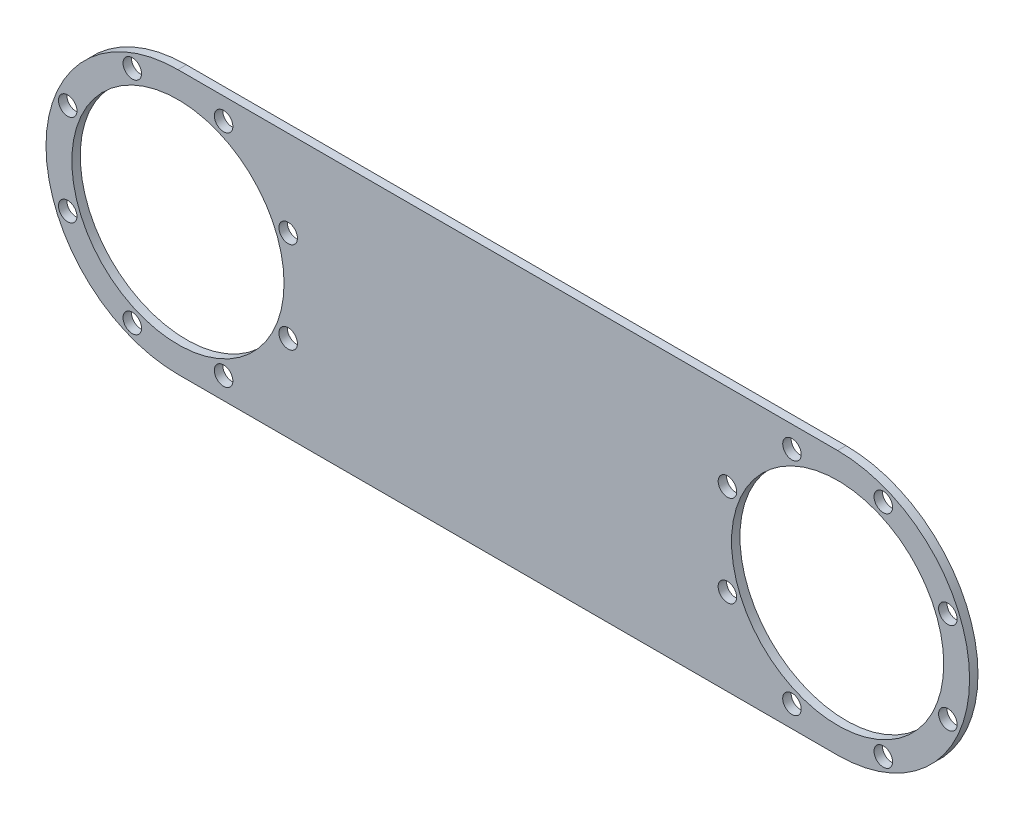
from build123d import *

# Parameters (mm, degrees)
SKETCH_1_R      = 3.3
SKETCH_1_R_2    = 37.8
EXTRUDE_1_DEPTH = 3


with BuildPart() as part:
    # 草图1 → 凸台-拉伸1 (new body)
    with BuildSketch(Plane.XY):
        with BuildLine():
            Line((0, -47), (235, -47))
            ThreePointArc((235, -47), (282, 0), (235, 47))
            Line((235, 47), (0, 47))
            ThreePointArc((0, 47), (-47, 0), (0, -47))
        make_face()
        with Locations((16.264045876, -39.264880132)):
            Circle(SKETCH_1_R, mode=Mode.SUBTRACT)
        with Locations((39.264880132, -16.264045876)):
            Circle(SKETCH_1_R, mode=Mode.SUBTRACT)
        with Locations((39.264880132, 16.264045876)):
            Circle(SKETCH_1_R, mode=Mode.SUBTRACT)
        with Locations((16.264045876, 39.264880132)):
            Circle(SKETCH_1_R, mode=Mode.SUBTRACT)
        with Locations((-16.264045876, 39.264880132)):
            Circle(SKETCH_1_R, mode=Mode.SUBTRACT)
        with Locations((-39.264880132, 16.264045876)):
            Circle(SKETCH_1_R, mode=Mode.SUBTRACT)
        with Locations((-39.264880132, -16.264045876)):
            Circle(SKETCH_1_R, mode=Mode.SUBTRACT)
        with Locations((-16.264045876, -39.264880132)):
            Circle(SKETCH_1_R, mode=Mode.SUBTRACT)
        with Locations((251.264045876, -39.264880132)):
            Circle(SKETCH_1_R, mode=Mode.SUBTRACT)
        with Locations((274.264880132, -16.264045876)):
            Circle(SKETCH_1_R, mode=Mode.SUBTRACT)
        with Locations((274.264880132, 16.264045876)):
            Circle(SKETCH_1_R, mode=Mode.SUBTRACT)
        with Locations((251.264045876, 39.264880132)):
            Circle(SKETCH_1_R, mode=Mode.SUBTRACT)
        with Locations((218.735954124, 39.264880132)):
            Circle(SKETCH_1_R, mode=Mode.SUBTRACT)
        with Locations((195.735119868, 16.264045876)):
            Circle(SKETCH_1_R, mode=Mode.SUBTRACT)
        with Locations((195.735119868, -16.264045876)):
            Circle(SKETCH_1_R, mode=Mode.SUBTRACT)
        with Locations((218.735954124, -39.264880132)):
            Circle(SKETCH_1_R, mode=Mode.SUBTRACT)
        Circle(SKETCH_1_R_2, mode=Mode.SUBTRACT)
        with Locations((235, 0)):
            Circle(SKETCH_1_R_2, mode=Mode.SUBTRACT)
    extrude(amount=EXTRUDE_1_DEPTH)


solid = part.part
